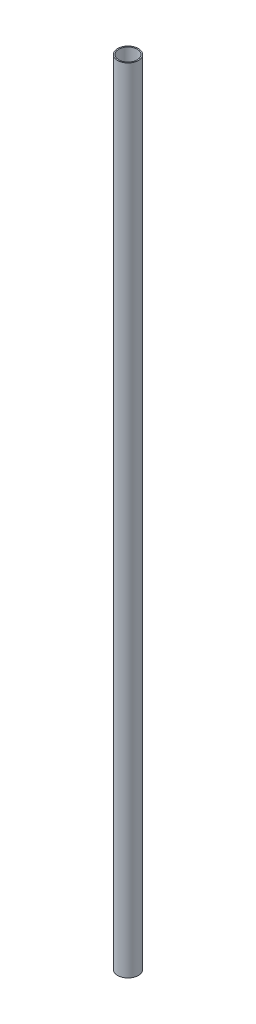
from build123d import *

# Parameters (mm, degrees)
TUBE_STOCK_EXTRUDE_DEPTH      = 241.3
TUBE_STOCK_EXTRUDE_DEPTH_BACK = 241.3
SKETCH2_R                     = 6.35
SKETCH2_R_2                   = 5.6134


with BuildPart() as part:
    # Sketch2 → Tube Stock - Extrude (new, two sides: drawn at the far end of the back side and taken through both)
    with BuildSketch(Plane(origin=(0, 0, 0), x_dir=(1, 0, 0), z_dir=(0, 1, 0)).offset(-TUBE_STOCK_EXTRUDE_DEPTH_BACK)):
        with Locations(Location((0, 0, 0), (0, 0, 270))):
            Circle(SKETCH2_R)
        with Locations(Location((0, 0, 0), (0, 0, 270))):
            Circle(SKETCH2_R_2, mode=Mode.SUBTRACT)
    extrude(amount=TUBE_STOCK_EXTRUDE_DEPTH + TUBE_STOCK_EXTRUDE_DEPTH_BACK)


solid = part.part
